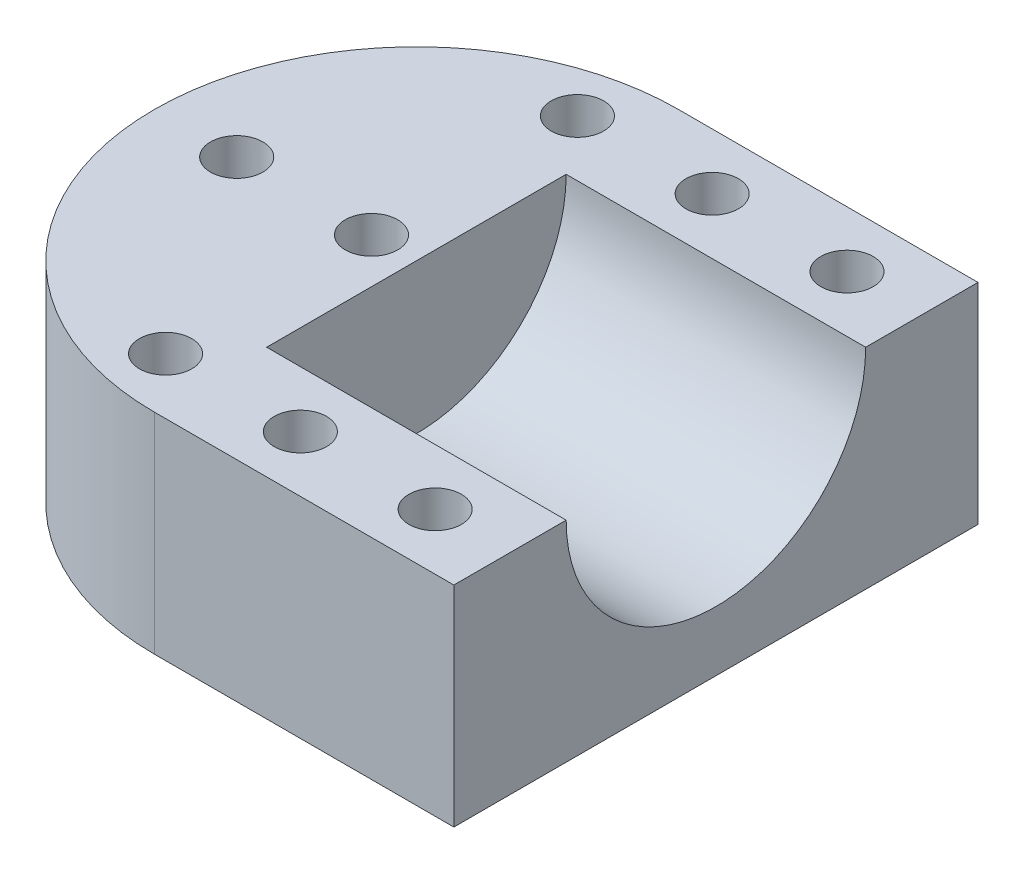
from build123d import *

# Parameters (mm, degrees)
BOSS_EXTRUDE1_DEPTH      = 14
BOSS_EXTRUDE1_DEPTH_BACK = 14
SKETCH3_R                = 10
CUT_EXTRUDE1_DEPTH       = 20
CUT_EXTRUDE3_DEPTH       = 39
SKETCH5_R                = 1.75
CUT_EXTRUDE4_DEPTH       = 39
SKETCH6_R                = 3.25
CUT_EXTRUDE5_DEPTH       = 1.5


with BuildPart() as part:
    # Sketch1 → Boss-Extrude1 (new, two sides: drawn at the far end of the back side and taken through both)
    with BuildSketch(Plane(origin=(0, 0, 0), x_dir=(1, 0, 0), z_dir=(0, 1, 0)).offset(-BOSS_EXTRUDE1_DEPTH_BACK)):
        with BuildLine():
            Line((20, 17.5), (0, 17.5))
            ThreePointArc((0, 17.5), (-17.5, -1.3e-08), (2.7e-08, -17.5))
            Line((2.7e-08, -17.5), (20, -17.5))
            Line((20, -17.5), (20, 17.5))
        make_face()
    extrude(amount=BOSS_EXTRUDE1_DEPTH + BOSS_EXTRUDE1_DEPTH_BACK)

    # Sketch3 → Cut-Extrude1 (cut)
    with BuildSketch(Plane(origin=(20, 0, 0), x_dir=(0, 0, -1), z_dir=(1, 0, 0))):
        Circle(SKETCH3_R)
    extrude(amount=-CUT_EXTRUDE1_DEPTH, mode=Mode.SUBTRACT)

    # Sketch4 → Cut-Extrude3 (cut)
    with BuildSketch(Plane(origin=(20, 0, 0), x_dir=(0, 0, -1), z_dir=(1, 0, 0))):
        Polygon((-29.488337181, 0), (29.963955523, 0), (3.938373511, 60.173176489), align=None)
    extrude(amount=-CUT_EXTRUDE3_DEPTH, mode=Mode.SUBTRACT)

    # Sketch5 → Cut-Extrude4 (cut)
    with BuildSketch(Plane(origin=(0, 0, 0), x_dir=(1, 0, 0), z_dir=(0, 1, 0))):
        with Locations((15, 13.75)):
            Circle(SKETCH5_R)
        with Locations((6, 13.75)):
            Circle(SKETCH5_R)
        with Locations((-3, 13.75)):
            Circle(SKETCH5_R)
        with Locations((-3, 0)):
            Circle(SKETCH5_R)
        with Locations((-12, 0)):
            Circle(SKETCH5_R)
        with Locations((15, -13.75)):
            Circle(SKETCH5_R)
        with Locations((6, -13.75)):
            Circle(SKETCH5_R)
        with Locations((-3, -13.75)):
            Circle(SKETCH5_R)
    extrude(amount=-CUT_EXTRUDE4_DEPTH, mode=Mode.SUBTRACT)

    # Sketch6 → Cut-Extrude5 (cut)
    with BuildSketch(Plane.XZ.offset(14)):
        with Locations((-3, 13.75)):
            Circle(SKETCH6_R)
        with Locations((6, 13.75)):
            Circle(SKETCH6_R)
        with Locations((15, 13.75)):
            Circle(SKETCH6_R)
        with Locations((-12, 0)):
            Circle(SKETCH6_R)
        with Locations((-3, 0)):
            Circle(SKETCH6_R)
        with Locations((-3, -13.75)):
            Circle(SKETCH6_R)
        with Locations((6, -13.75)):
            Circle(SKETCH6_R)
        with Locations((15, -13.75)):
            Circle(SKETCH6_R)
    extrude(amount=-CUT_EXTRUDE5_DEPTH, mode=Mode.SUBTRACT)


solid = part.part
